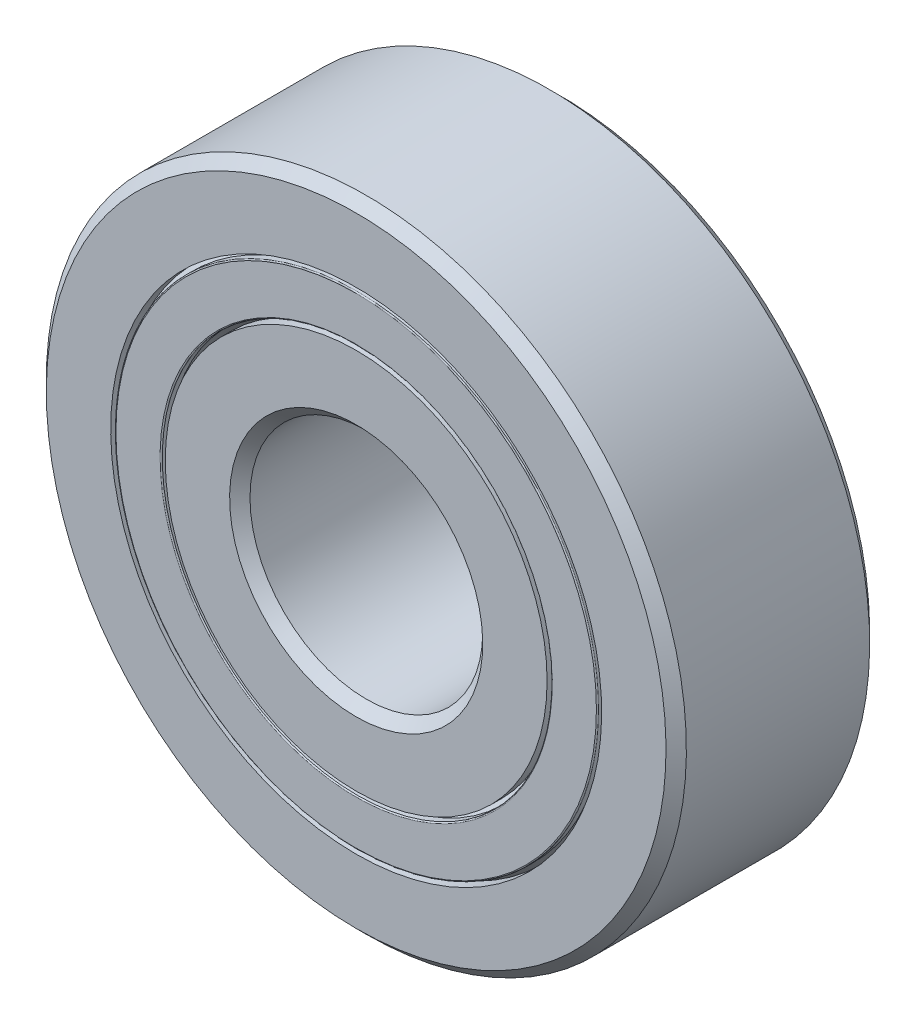
from build123d import *

# Parameters (mm, degrees)
CIRPATTERN1_COUNT   = 7
SKETCH7_R           = 7.96875
SKETCH7_R_2         = 7.5
BOSS_EXTRUDE1_DEPTH = 0.583333333
FILLET1_R           = 0.038888889
FILLET2_R           = 0.038888889


with BuildPart() as part:
    # Sketch3 → Revolve1 (revolve)
    with BuildSketch(Plane(origin=(0, 0, 0), x_dir=(0, 0, -1), z_dir=(1, 0, 0)), mode=Mode.PRIVATE) as revolve1_sk:
        with BuildLine():
            Line((3.15, 11), (3.5, 10.65))
            Line((3.5, 10.65), (3.5, 8.4375))
            Line((3.5, 8.4375), (1.555555556, 8.4375))
            ThreePointArc((1.555555556, 8.4375), (0, 9.316221169), (-1.555555556, 8.4375))
            Line((-1.555555556, 8.4375), (-3.5, 8.4375))
            Line((-3.5, 8.4375), (-3.5, 10.65))
            Line((-3.5, 10.65), (-3.15, 11))
            Line((-3.15, 11), (3.15, 11))
        make_face()
    revolve(revolve1_sk.sketch.rotate(Axis((0, 0, 3.5), (0, 0, -1)), 180), axis=Axis((0, 0, 3.5), (0, 0, -1)))


with BuildPart() as body_2:
    # Sketch4 → Revolve2 (revolve)
    with BuildSketch(Plane(origin=(0, 0, 0), x_dir=(0, 0, -1), z_dir=(1, 0, 0)), mode=Mode.PRIVATE) as revolve2_sk:
        with BuildLine():
            Line((-3.15, 4), (-3.5, 4.35))
            Line((-3.5, 4.35), (-3.5, 6.5625))
            Line((-3.5, 6.5625), (-1.555555556, 6.5625))
            ThreePointArc((-1.555555556, 6.5625), (0, 5.683778831), (1.555555556, 6.5625))
            Line((1.555555556, 6.5625), (3.5, 6.5625))
            Line((3.5, 6.5625), (3.5, 4.35))
            Line((3.5, 4.35), (3.15, 4))
            Line((3.15, 4), (-3.15, 4))
        make_face()
    revolve(revolve2_sk.sketch.rotate(Axis((0, 0, 3.5), (0, 0, -1)), 180), axis=Axis((0, 0, 3.5), (0, 0, -1)))


with BuildPart() as body_3:
    # Sketch5 → Revolve3 (revolve)
    with BuildSketch(Plane(origin=(0, 0, 0), x_dir=(0, 0, -1), z_dir=(1, 0, 0))):
        with BuildLine():
            Line((-1.816221169, 7.5), (1.816221169, 7.5))
            ThreePointArc((1.816221169, 7.5), (0, 9.316221169), (-1.816221169, 7.5))
        make_face()
    revolve(axis=Axis((0, 7.5, 1.816221169), (0, 0, -1)))


with BuildPart() as body_4:
    # Sketch6 → Revolve4 (revolve)
    with BuildSketch(Plane(origin=(0, 0, 0), x_dir=(0, 0, -1), z_dir=(1, 0, 0))):
        with BuildLine():
            Line((-1.754688797, 7.96875), (-2.045573997, 7.96875))
            ThreePointArc((-2.045573997, 7.96875), (-2.191016598, 7.5), (-2.045573997, 7.03125))
            Line((-2.045573997, 7.03125), (-1.754688797, 7.03125))
            ThreePointArc((-1.754688797, 7.03125), (-1.816221169, 7.5), (-1.754688797, 7.96875))
        make_face()
    revolve(axis=Axis((0, 11, 0), (0, -1, 0)))


with BuildPart() as cirpattern1_1:
    # CirPattern1: pattern copy
    add(body_4.part.rotate(Axis((0, 0, 0), (0, 0, 1)), 1 * 360 / CIRPATTERN1_COUNT))


with BuildPart() as cirpattern1_2:
    # CirPattern1: pattern copy
    add(body_4.part.rotate(Axis((0, 0, 0), (0, 0, 1)), 2 * 360 / CIRPATTERN1_COUNT))


with BuildPart() as cirpattern1_3:
    # CirPattern1: pattern copy
    add(body_4.part.rotate(Axis((0, 0, 0), (0, 0, 1)), 3 * 360 / CIRPATTERN1_COUNT))


with BuildPart() as cirpattern1_4:
    # CirPattern1: pattern copy
    add(body_4.part.rotate(Axis((0, 0, 0), (0, 0, 1)), 4 * 360 / CIRPATTERN1_COUNT))


with BuildPart() as cirpattern1_5:
    # CirPattern1: pattern copy
    add(body_4.part.rotate(Axis((0, 0, 0), (0, 0, 1)), 5 * 360 / CIRPATTERN1_COUNT))


with BuildPart() as cirpattern1_6:
    # CirPattern1: pattern copy
    add(body_4.part.rotate(Axis((0, 0, 0), (0, 0, 1)), 6 * 360 / CIRPATTERN1_COUNT))


with BuildPart() as cirpattern1_7:
    # CirPattern1: pattern copy
    add(body_3.part.rotate(Axis((0, 0, 0), (0, 0, 1)), 1 * 360 / CIRPATTERN1_COUNT))


with BuildPart() as cirpattern1_8:
    # CirPattern1: pattern copy
    add(body_3.part.rotate(Axis((0, 0, 0), (0, 0, 1)), 2 * 360 / CIRPATTERN1_COUNT))


with BuildPart() as cirpattern1_9:
    # CirPattern1: pattern copy
    add(body_3.part.rotate(Axis((0, 0, 0), (0, 0, 1)), 3 * 360 / CIRPATTERN1_COUNT))


with BuildPart() as cirpattern1_10:
    # CirPattern1: pattern copy
    add(body_3.part.rotate(Axis((0, 0, 0), (0, 0, 1)), 4 * 360 / CIRPATTERN1_COUNT))


with BuildPart() as cirpattern1_11:
    # CirPattern1: pattern copy
    add(body_3.part.rotate(Axis((0, 0, 0), (0, 0, 1)), 5 * 360 / CIRPATTERN1_COUNT))


with BuildPart() as cirpattern1_12:
    # CirPattern1: pattern copy
    add(body_3.part.rotate(Axis((0, 0, 0), (0, 0, 1)), 6 * 360 / CIRPATTERN1_COUNT))


with BuildPart() as body_17:
    # Sketch7 → Boss-Extrude1 (new, symmetric)
    with BuildSketch(Plane.XY):
        Circle(SKETCH7_R)
        Circle(SKETCH7_R_2, mode=Mode.SUBTRACT)
    extrude(amount=BOSS_EXTRUDE1_DEPTH, both=True)


with BuildPart() as body_18:
    # Sketch8 → Revolve5 (revolve)
    with BuildSketch(Plane(origin=(0, 0, 0), x_dir=(0, 0, -1), z_dir=(1, 0, 0)), mode=Mode.PRIVATE) as revolve5_sk:
        Polygon((-3.5, 8.296875), (-3.240740741, 8.296875), (-3.111111111, 8.4375), (-3.111111111, 8.296875), (-3.111111111, 6.703125), (-3.111111111, 6.5625), (-3.240740741, 6.703125), (-3.5, 6.703125), align=None)
        Polygon((3.5, 8.296875), (3.5, 6.703125), (3.240740741, 6.703125), (3.111111111, 6.5625), (3.111111111, 6.703125), (3.111111111, 8.296875), (3.111111111, 8.4375), (3.240740741, 8.296875), align=None)
    revolve(revolve5_sk.sketch.rotate(Axis((0, 0, 3.5), (0, 0, -1)), 180), axis=Axis((0, 0, 3.5), (0, 0, -1)))

    # Fillet1
    fillet1_edges = [body_18.edges().sort_by_distance(p)[0] for p in [
        (0, 8.296875, 3.5),
        (0, 6.703125, 3.5),
    ]]
    fillet(fillet1_edges, radius=FILLET1_R)

    # Fillet2
    fillet2_edges = [body_18.edges().sort_by_distance(p)[0] for p in [
        (0, 8.296875, -3.5),
        (0, 6.703125, -3.5),
    ]]
    fillet(fillet2_edges, radius=FILLET2_R)


solid = Compound([part.part, body_2.part, body_3.part, body_4.part, cirpattern1_1.part, cirpattern1_2.part, cirpattern1_3.part, cirpattern1_4.part, cirpattern1_5.part, cirpattern1_6.part, cirpattern1_7.part, cirpattern1_8.part, cirpattern1_9.part, cirpattern1_10.part, cirpattern1_11.part, cirpattern1_12.part, body_17.part, body_18.part])
